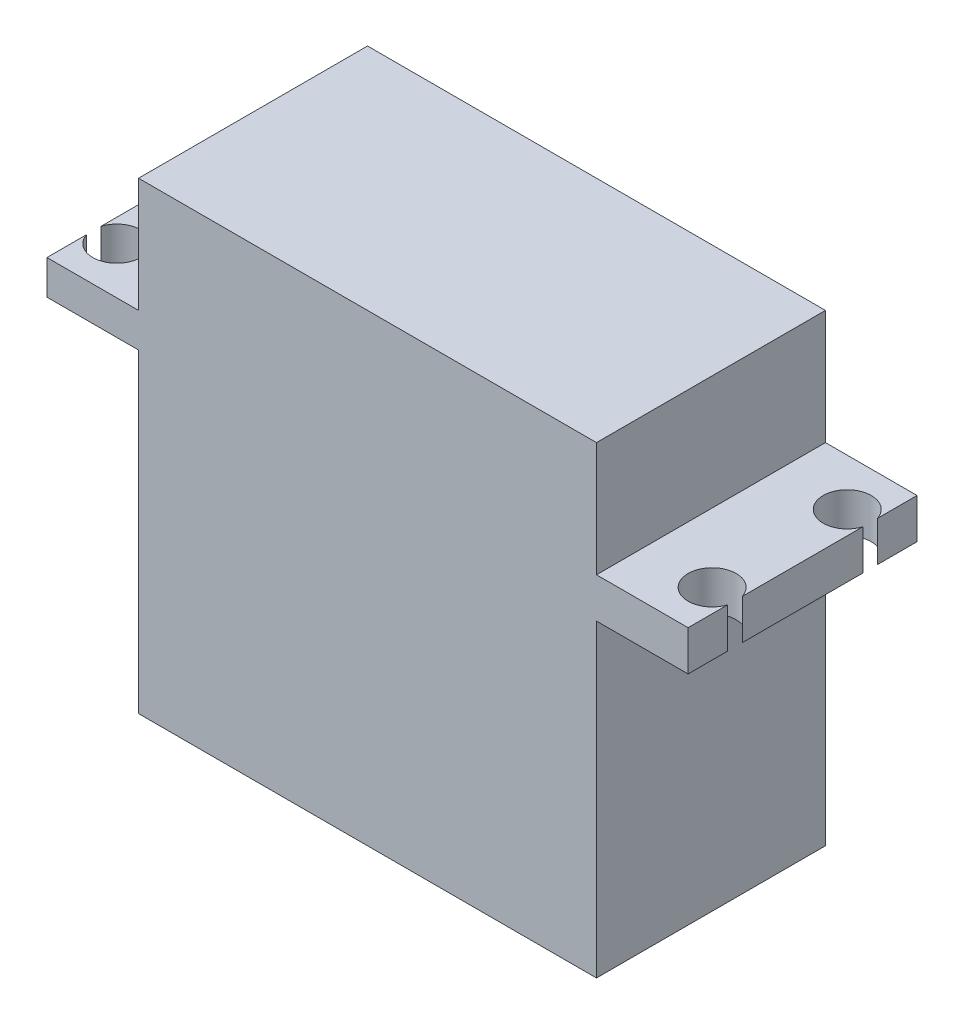
from build123d import *

# Parameters (mm, degrees)
SKETCH2_W           = 40
SKETCH2_H           = 40.5
BOSS_EXTRUDE1_DEPTH = 20
SKETCH3_W           = 20
SKETCH3_H           = 3.5
BOSS_EXTRUDE2_DEPTH = 8
SKETCH4_R           = 2.1
CUT_EXTRUDE1_DEPTH  = 8
SKETCH5_W           = 20
SKETCH5_H           = 3
BOSS_EXTRUDE3_DEPTH = 8
SKETCH6_R           = 2.1
CUT_EXTRUDE2_DEPTH  = 8


with BuildPart() as part:
    # Sketch2 → Boss-Extrude1 (new body)
    with BuildSketch(Plane.XY):
        with Locations((20, 20.25)):
            Rectangle(SKETCH2_W, SKETCH2_H)
    extrude(amount=-BOSS_EXTRUDE1_DEPTH)

    # Sketch3 → Boss-Extrude2 (add)
    with BuildSketch(Plane(origin=(40, 0, 0), x_dir=(0, 0, -1), z_dir=(1, 0, 0))):
        with Locations((10, 28.75)):
            Rectangle(SKETCH3_W, SKETCH3_H)
    extrude(amount=BOSS_EXTRUDE2_DEPTH)

    # Sketch4 → Cut-Extrude1 (cut)
    with BuildSketch(Plane(origin=(0, 30.5, 0), x_dir=(1, 0, 0), z_dir=(0, 1, 0))):
        with Locations((46, 15.9)):
            Circle(SKETCH4_R)
        with Locations((46, 4.1)):
            Circle(SKETCH4_R)
    extrude(amount=-CUT_EXTRUDE1_DEPTH, mode=Mode.SUBTRACT)

    # Sketch5 → Boss-Extrude3 (add)
    with BuildSketch(Plane.ZY):
        with Locations((-10, 29)):
            Rectangle(SKETCH5_W, SKETCH5_H)
    extrude(amount=BOSS_EXTRUDE3_DEPTH)

    # Sketch6 → Cut-Extrude2 (cut)
    with BuildSketch(Plane(origin=(0, 30.5, 0), x_dir=(1, 0, 0), z_dir=(0, 1, 0))):
        with Locations((-6, 15.9)):
            Circle(SKETCH6_R)
        with Locations((-6, 4.1)):
            Circle(SKETCH6_R)
    extrude(amount=-CUT_EXTRUDE2_DEPTH, mode=Mode.SUBTRACT)


solid = part.part
